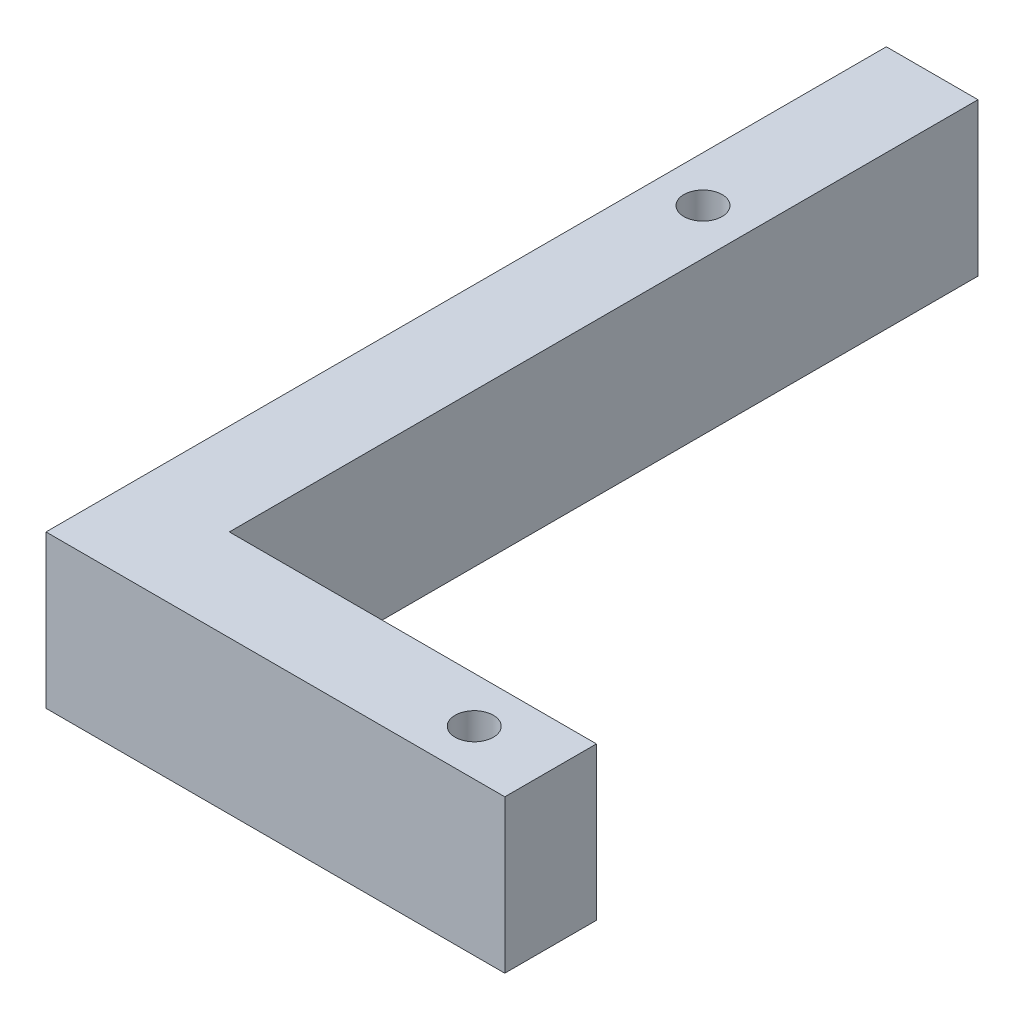
from build123d import *

# Parameters (mm, degrees)
SKETCH1_R           = 1.25
BOSS_EXTRUDE1_DEPTH = 10


with BuildPart() as part:
    # Sketch1 → Boss-Extrude1 (new body)
    # profile 1 of 2: a face of its own
    with BuildSketch(Plane(origin=(0, 0, 0), x_dir=(1, 0, 0), z_dir=(0, 1, 0))):
        Polygon((6, 55), (3, 55), (0, 55), (0, 0), (6, 0), (6, 6), align=None)
        with BuildLine():
            ThreePointArc((4.25, 40), (2.116116524, 39.116116524), (3, 41.25))
            ThreePointArc((3, 41.25), (3.883883476, 40.883883476), (4.25, 40))
        make_face(mode=Mode.SUBTRACT)
    # profile 2 of 2: a face of its own
    with BuildSketch(Plane(origin=(0, 0, 0), x_dir=(1, 0, 0), z_dir=(0, 1, 0))):
        Polygon((30.028010211, 6), (6, 6), (6, 0), (30.028010211, 0), (30.028010211, 3), align=None)
        with Locations(Location((25.028010211, 3, 0), (0, 0, 270))):
            Circle(SKETCH1_R, mode=Mode.SUBTRACT)
    extrude(amount=BOSS_EXTRUDE1_DEPTH)


solid = part.part
